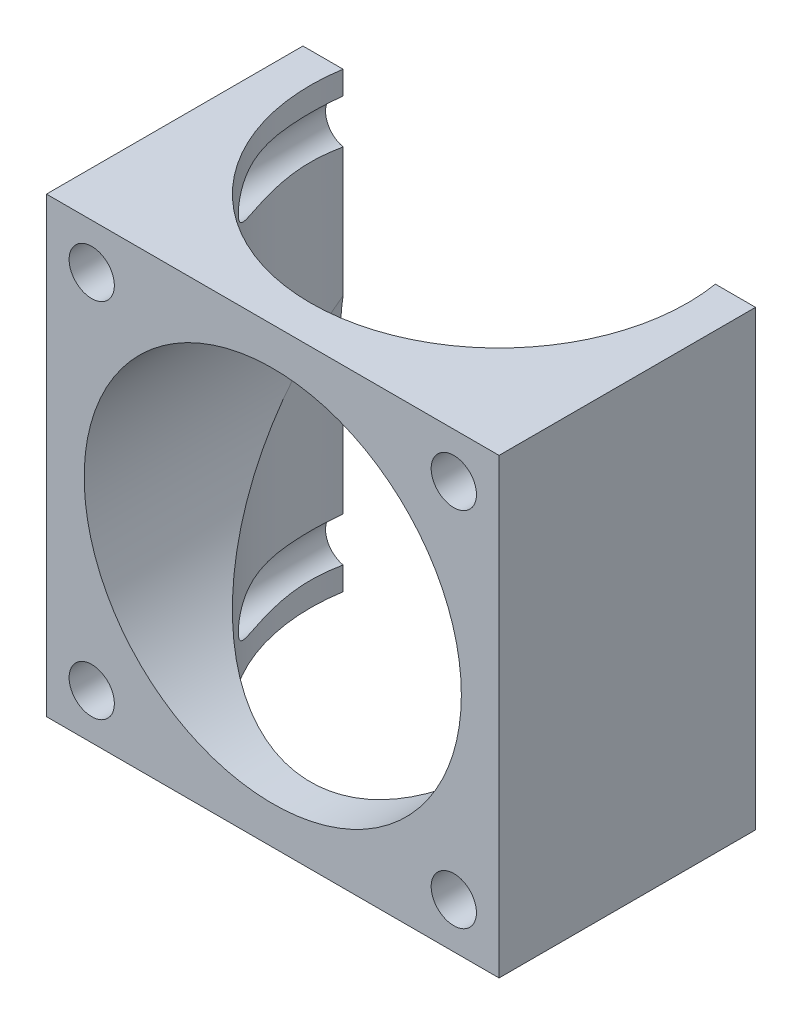
from build123d import *

# Parameters (mm, degrees)
P_IDAT_VYSUNUT_M1_DEPTH  = 30
SKICA2_R                 = 12.5
ODEBRAT_VYSUNUT_M1_DEPTH = 30
SKICA3_R                 = 1.5
ODEBRAT_VYSUNUT_M2_DEPTH = 30


with BuildPart() as part:
    # Skica1 → Přidat vysunutím1 (new body)
    with BuildSketch(Plane(origin=(0, 0, 0), x_dir=(1, 0, 0), z_dir=(0, 1, 0))):
        with BuildLine():
            Line((-15, 2), (-15, 0))
            Line((-15, 0), (-15, -15))
            Line((-15, -15), (15, -15))
            Line((15, -15), (15, 0))
            Line((15, 0), (15, 2))
            Line((15, 2), (12.338962679, 2))
            ThreePointArc((12.338962679, 2), (12.459675628, 1.00323639), (12.5, 0))
            ThreePointArc((12.5, 0), (-1.00323639, -12.459675628), (-12.338962679, 2))
            Line((-12.338962679, 2), (-15, 2))
        make_face()
    extrude(amount=P_IDAT_VYSUNUT_M1_DEPTH)

    # Skica2 → Odebrat vysunutím1 (cut)
    with BuildSketch(Plane.XY.offset(15)):
        with Locations((0, 15)):
            Circle(SKICA2_R)
    extrude(amount=-ODEBRAT_VYSUNUT_M1_DEPTH, mode=Mode.SUBTRACT)

    # Skica3 → Odebrat vysunutím2 (cut)
    with BuildSketch(Plane.XY.offset(15)):
        with Locations((-12, 27)):
            Circle(SKICA3_R)
        with Locations((12, 27)):
            Circle(SKICA3_R)
        with Locations((12, 3)):
            Circle(SKICA3_R)
        with Locations((-12, 3)):
            Circle(SKICA3_R)
    extrude(amount=-ODEBRAT_VYSUNUT_M2_DEPTH, mode=Mode.SUBTRACT)


solid = part.part
